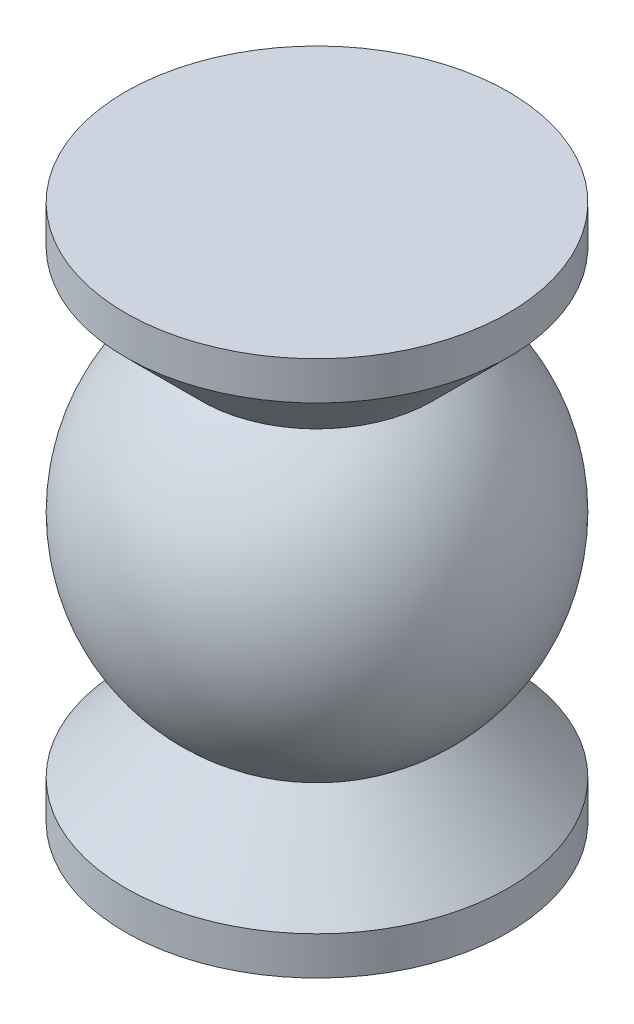
from build123d import *


with BuildPart() as part:
    # 草图1 → 旋转1 (revolve)
    with BuildSketch(Plane.XY, mode=Mode.PRIVATE) as revolve_1_sk:
        with BuildLine():
            Line((15, 20), (25, 30))
            Line((25, 30), (25, 35))
            Line((25, 35), (0, 35))
            Line((0, 35), (0, -35))
            Line((0, -35), (25, -35))
            Line((25, -35), (25, -30))
            Line((25, -30), (15, -20))
            ThreePointArc((15, -20), (25, 0), (15, 20))
        make_face()
    revolve(revolve_1_sk.sketch.rotate(Axis((0, 35, 0), (0, -1, 0)), 180), axis=Axis((0, 35, 0), (0, -1, 0)))


solid = part.part
